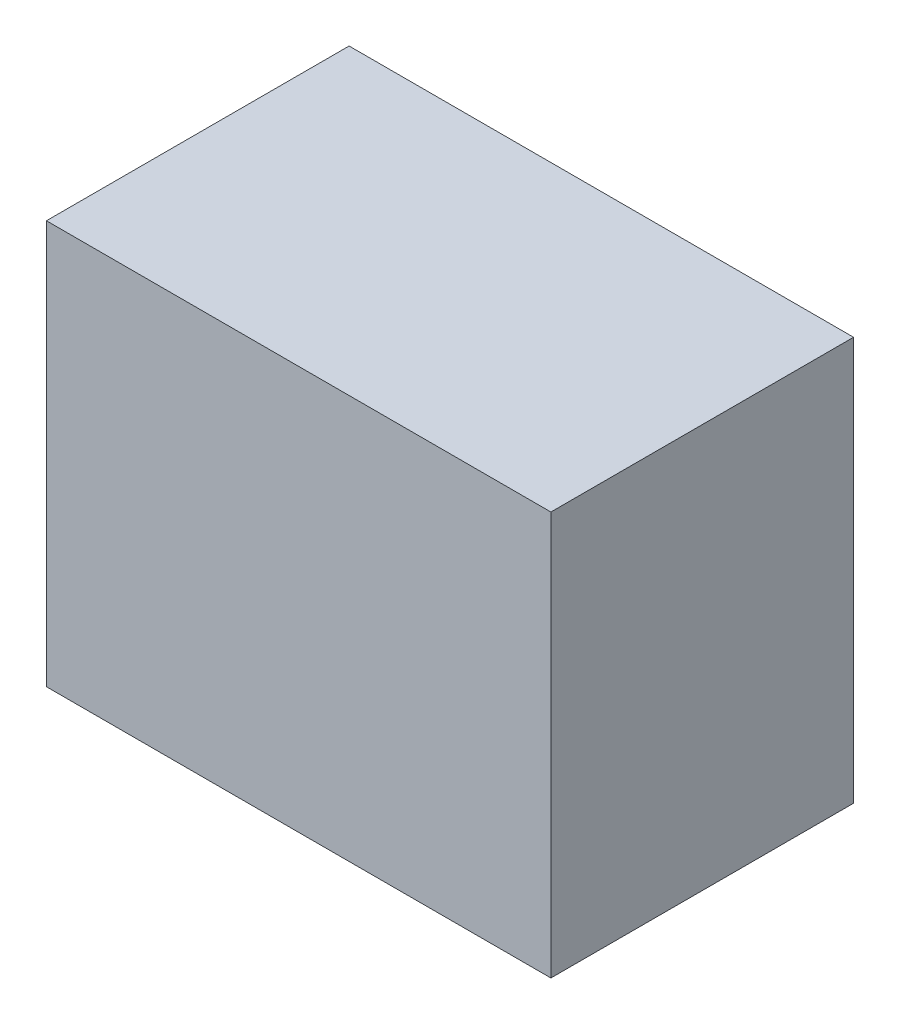
from build123d import *

# Parameters (mm, degrees)
SKETCH1_W           = 12.5
SKETCH1_H           = 7.5
BOSS_EXTRUDE1_DEPTH = 10


with BuildPart() as part:
    # Sketch1 → Boss-Extrude1 (new body)
    with BuildSketch(Plane(origin=(0, 0, 0), x_dir=(1, 0, 0), z_dir=(0, 1, 0))):
        Rectangle(SKETCH1_W, SKETCH1_H)
    extrude(amount=BOSS_EXTRUDE1_DEPTH)


solid = part.part
